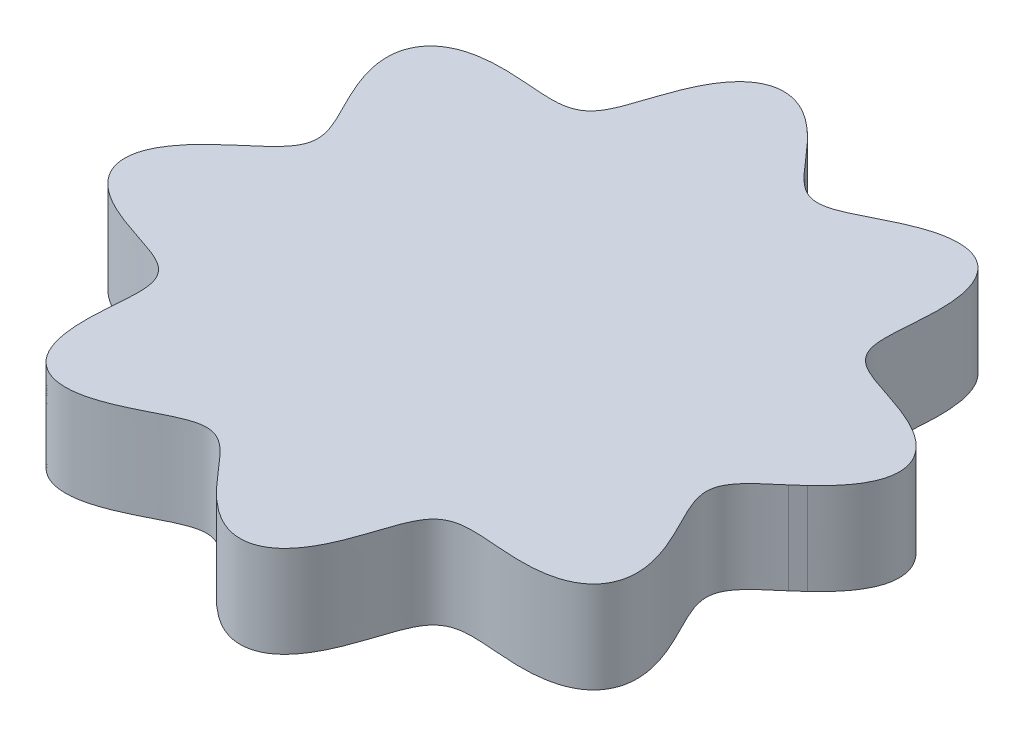
from build123d import *

# Parameters (mm, degrees)
AUFSATZ_LINEAR_AUSTRAGEN1_DEPTH = 2.3


with BuildPart() as part:
    # Skizze2 → Aufsatz-Linear austragen1 (new body)
    with BuildSketch(Plane(origin=(0, 0, 0), x_dir=(1, 0, 0), z_dir=(0, 1, 0))):
        with BuildLine():
            add(Edge.make_bspline(
                [(7.4, 0), (7.436444637, 0.033711289), (7.507393332, 0.10115076), (7.677507333, 0.26781721), (7.803046409, 0.414528225), (7.966713512, 0.620038661), (8.083715078, 0.813084974), (8.189280376, 1.03370683), (8.251084354, 1.261915989), (8.271546489, 1.545098595), (8.194083175, 1.865605739), (7.980990548, 2.181873599), (7.650888728, 2.451872963), (7.272742314, 2.661017289), (6.867069239, 2.826816445), (6.491863181, 2.952704051), (6.155870259, 3.060451976), (5.862839787, 3.165817548), (5.619043723, 3.277966717), (5.395259628, 3.432746132), (5.240025713, 3.66090414), (5.179886815, 3.926434654), (5.168286937, 4.19423741), (5.182452986, 4.505165905), (5.211248214, 4.856360087), (5.239166651, 5.25103749), (5.241882713, 5.688523709), (5.195732504, 6.118211543), (5.074621302, 6.526134244), (4.843885734, 6.886014194), (4.485088511, 7.119985315), (4.059923107, 7.186674119), (3.632300808, 7.134753969), (3.216669207, 7.007539253), (2.815124255, 6.835047832), (2.463321377, 6.658022977), (2.152585657, 6.4987175), (1.874123937, 6.370479996), (1.626899031, 6.283303033), (1.366275663, 6.243579792), (1.108348414, 6.299898422), (0.890210519, 6.437452642), (0.702843738, 6.606756681), (0.499191359, 6.826800768), (0.274871461, 7.090549619), (0.054000713, 7.346871845), (-0.174123606, 7.586178571), (-0.417055242, 7.809794894), (-0.672951623, 8.008466616), (-0.997608379, 8.191381569), (-1.41172477, 8.292863609), (-1.829085639, 8.219775799), (-2.181453855, 7.980642019), (-2.451902701, 7.651471979), (-2.660806928, 7.272709834), (-2.826811887, 6.867456336), (-2.952589785, 6.491973001), (-3.060409807, 6.1561361), (-3.165724845, 5.86300715), (-3.277875143, 5.61924431), (-3.432595739, 5.395404482), (-3.660709182, 5.240110701), (-3.926225487, 5.179905509), (-4.194024973, 5.168287334), (-4.504947751, 5.182434868), (-4.856136798, 5.211230735), (-5.250806124, 5.239155306), (-5.688284664, 5.241892189), (-6.117967669, 5.195777361), (-6.525897492, 5.074721224), (-6.885820057, 4.844070158), (-7.11989554, 4.485340917), (-7.18667732, 4.060179573), (-7.134808597, 3.632542551), (-7.007624546, 3.216892365), (-6.835146386, 2.815333368), (-6.658126851, 2.463519821), (-6.498813585, 2.152781412), (-6.370564629, 1.874319126), (-6.283354644, 1.627102887), (-6.243584642, 1.366484214), (-6.299802988, 1.108548241), (-6.437340903, 0.89036333), (-6.60657375, 0.703013255), (-6.82669884, 0.499295775), (-7.090261645, 0.275087004), (-7.388609416, 0.018094959), (-7.704210328, -0.28904051), (-7.981019458, -0.624445208), (-8.19134839, -0.997414225), (-8.292811734, -1.411435783), (-8.219903983, -1.828853232), (-7.980805941, -2.181260049), (-7.65169055, -2.451773552), (-7.272919512, -2.660701606), (-6.86767901, -2.826736095), (-6.492183721, -2.952519197), (-6.156345174, -3.060343073), (-5.863204764, -3.165645233), (-5.619428373, -3.277776455), (-5.395558606, -3.432449357), (-5.240190075, -3.66051184), (-5.179928123, -3.926017914), (-5.168285046, -4.193811539), (-5.182418738, -4.504730138), (-5.211211511, -4.855913323), (-5.239145774, -5.250574626), (-5.241899536, -5.688046055), (-5.195825001, -6.117723003), (-5.074817471, -6.525661845), (-4.844259809, -6.885624186), (-4.485584873, -7.119808423), (-4.060451264, -7.186675526), (-3.632756739, -7.134872191), (-3.217168148, -7.007692639), (-2.815450217, -6.835275099), (-2.405266421, -6.628675059), (-2.036300743, -6.439109269), (-1.692890662, -6.293518709), (-1.366776597, -6.243557679), (-1.108691161, -6.299733942), (-0.890561515, -6.437200434), (-0.703140927, -6.606429725), (-0.499452588, -6.826529673), (-0.275222329, -7.090093413), (-0.018255223, -7.388436055), (0.288869925, -7.704047373), (0.624241462, -7.980875676), (0.99717955, -8.191247346), (1.411168431, -8.292795989), (1.828607381, -8.220009649), (2.181075273, -7.980985005), (2.451637658, -7.651897857), (2.660600798, -7.27313676), (2.826657202, -6.867896521), (2.952450512, -6.492397609), (3.060275261, -6.15655248), (3.165566223, -5.863403309), (3.277677448, -5.619611973), (3.432303242, -5.395712993), (3.660314338, -5.240269444), (3.925810545, -5.179950684), (4.193597815, -5.16828306), (4.504513013, -5.182401973), (4.855689015, -5.211193474), (5.250344468, -5.239134268), (5.687805493, -5.241909765), (6.117481224, -5.195868309), (6.525422302, -5.074919467), (6.885433998, -4.844440853), (7.119712037, -4.485842533), (7.186690357, -4.060698115), (7.134905523, -3.633015915), (7.007818742, -3.217358241), (6.835300714, -2.815716214), (6.658404366, -2.46397475), (6.513850845, -2.182225403), (6.412032611, -1.964275348), (6.350393734, -1.812410276), (6.308085335, -1.688199853), (6.276285712, -1.560793124), (6.259685149, -1.430331898), (6.264103094, -1.289027514), (6.299307469, -1.141884982), (6.360138215, -1.016285889), (6.431430666, -0.910575207), (6.496269824, -0.829097918), (6.552075059, -0.76597205), (6.670059002, -0.645444465), (6.771013039, -0.548468499), (6.993410779, -0.357126577), (7.094389209, -0.270884647), (7.147781373, -0.224628079)],
                knots=[0.081617274, 0.081617274, 0.081617274, 0.081617274, 0.081617274, 0.085058601, 0.088499928, 0.091941255, 0.095382582, 0.098823909, 0.102265236, 0.105706563, 0.10914789, 0.115060177, 0.120972464, 0.127308554, 0.133644643, 0.139980733, 0.146316822, 0.150202058, 0.154087293, 0.157972529, 0.161857764, 0.165739587, 0.169621409, 0.173503231, 0.177385053, 0.183715619, 0.190046184, 0.196376749, 0.202707314, 0.208614489, 0.214521664, 0.220593377, 0.226665089, 0.23298995, 0.239314811, 0.245639672, 0.251964533, 0.255758754, 0.259552974, 0.263347195, 0.267141415, 0.270794178, 0.274446941, 0.278099705, 0.281752468, 0.288124873, 0.294497278, 0.297683481, 0.300869683, 0.307242088, 0.313188371, 0.319134654, 0.325047042, 0.33095943, 0.337295629, 0.343631828, 0.349968026, 0.356304225, 0.360189528, 0.364074831, 0.367960135, 0.371845438, 0.375727193, 0.379608948, 0.383490703, 0.387372458, 0.393702913, 0.400033369, 0.406363824, 0.41269428, 0.418601354, 0.424508428, 0.430580243, 0.436652057, 0.442977029, 0.449302, 0.455626972, 0.461951943, 0.46574623, 0.469540516, 0.473334802, 0.477129088, 0.480781786, 0.484434484, 0.488087182, 0.49173988, 0.498112174, 0.504484469, 0.510856763, 0.517229058, 0.523175237, 0.529121417, 0.535033907, 0.540946397, 0.547282704, 0.553619012, 0.55995532, 0.566291627, 0.570176999, 0.57406237, 0.577947741, 0.581833112, 0.5857148, 0.589596487, 0.593478175, 0.597359862, 0.603690208, 0.610020554, 0.6163509, 0.622681246, 0.628588219, 0.634495192, 0.640567109, 0.646639025, 0.652964107, 0.65928919, 0.665614272, 0.671939354, 0.679528058, 0.68332241, 0.687116761, 0.690769394, 0.694422027, 0.698074659, 0.701727292, 0.708099476, 0.71447166, 0.720843843, 0.727216027, 0.733162104, 0.73910818, 0.745020771, 0.750933363, 0.757269779, 0.763606196, 0.769942613, 0.77627903, 0.780164469, 0.784049908, 0.787935347, 0.791820786, 0.795702406, 0.799584026, 0.803465647, 0.807347267, 0.813677503, 0.820007739, 0.826337976, 0.832668212, 0.838575084, 0.844481956, 0.850553975, 0.856625994, 0.862951186, 0.869276379, 0.875601572, 0.881926764, 0.885721182, 0.887618391, 0.889515599, 0.891412808, 0.893310017, 0.895207226, 0.897104435, 0.899552847, 0.90200126, 0.903225466, 0.904449672, 0.905673879, 0.906898085, 0.91179491, 0.916691735, 0.916691735, 0.916691735, 0.916691735, 0.916691735], degree=4))
            Line((7.147781373, -0.224628079), (7.4, 0))
        make_face()
    extrude(amount=AUFSATZ_LINEAR_AUSTRAGEN1_DEPTH)


solid = part.part
